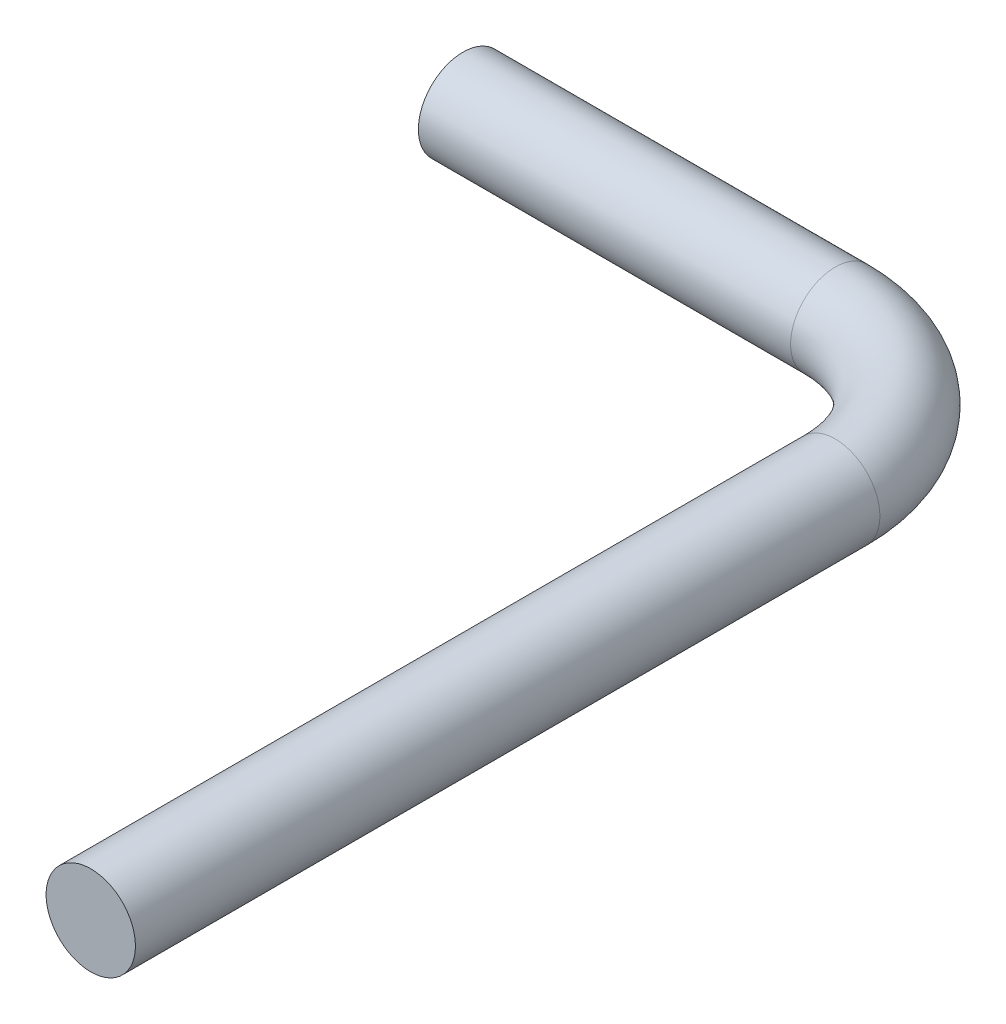
from build123d import *

# Parameters (mm, degrees)
CROQUIS3_R = 0.3


with BuildPart() as part:
    # Barrer1: sweep along a path in Croquis2
    with BuildLine(Plane(origin=(0, 0, 0), x_dir=(1, 0, 0), z_dir=(0, 1, 0))) as barrer1_path:
        Line((0, 0), (2.5, 0))
        ThreePointArc((2.5, 0), (3.207106781, -0.292893219), (3.5, -1))
        Line((3.5, -1), (3.5, -6))
    # Croquis3 → Barrer1 (sweep)
    with BuildSketch(Plane(origin=(0, 0, 0), x_dir=(0, 0, -1), z_dir=(1, 0, 0))):
        Circle(CROQUIS3_R)
    sweep(path=barrer1_path.line)


solid = part.part
